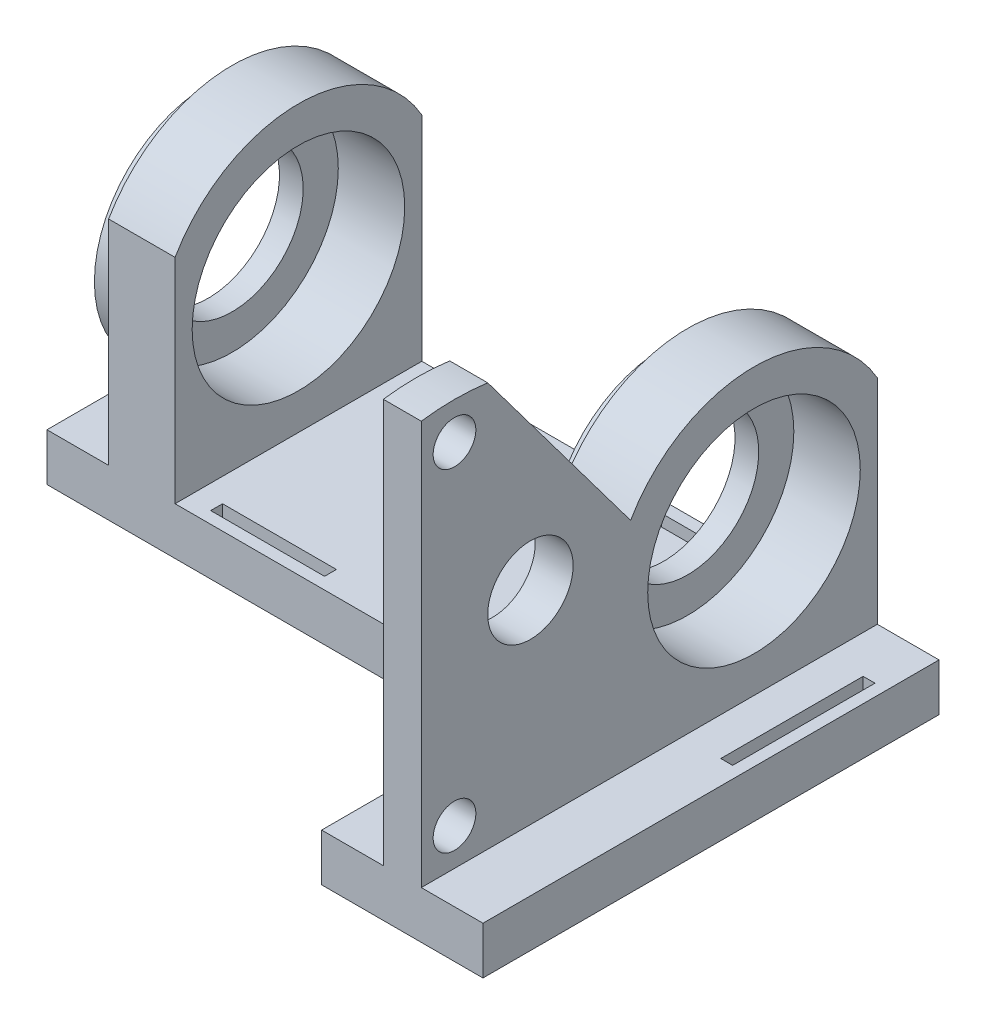
from build123d import *

# Parameters (mm, degrees)
SKETCH1_W                      = 20
SKETCH1_H                      = 26
SKETCH1_W_2                    = 1.25
SKETCH1_H_2                    = 15
BOSS_EXTRUDE5_DEPTH            = 5
SKETCH3_W                      = 7
SKETCH3_H                      = 26
BOSS_EXTRUDE6_DEPTH            = 40
CUT_EXTRUDE1_REACH             = 55.696
SKETCH5_R                      = 11.2
SKETCH6_W                      = 26
SKETCH6_H                      = 5
BOSS_EXTRUDE8_DEPTH            = 14
SKETCH8_R                      = 12
SKETCH8_R_2                    = 7.5
BOSS_EXTRUDE9_DEPTH            = 2.5
SKETCH9_R                      = 12
SKETCH9_R_2                    = 7.5
BOSS_EXTRUDE10_DEPTH           = 2.5
SKETCH7_W                      = 12
SKETCH7_H                      = 1.25
CUT_EXTRUDE2_DEPTH             = 10
BOSS_EXTRUDE11_DEPTH           = 37.12
SKETCH14_R                     = 2.25
SKETCH14_R_2                   = 4.5
CUT_EXTRUDE4_DEPTH             = 10
CUT_EXTRUDE5_REACH             = 85.48
CUT_EXTRUDE5_DIRECTION_2_REACH = 85.48


with BuildPart() as part:
    # Sketch1 → Boss-Extrude5 (new body)
    with BuildSketch(Plane(origin=(0, 0, 0), x_dir=(1, 0, 0), z_dir=(0, 1, 0))):
        with Locations((10, 13)):
            Rectangle(SKETCH1_W, SKETCH1_H)
        with Locations((1.875, 13)):
            Rectangle(SKETCH1_W_2, SKETCH1_H_2, mode=Mode.SUBTRACT)
    boss_extrude5 = extrude(amount=BOSS_EXTRUDE5_DEPTH)

    # Sketch3 → Boss-Extrude6 (add)
    with BuildSketch(Plane(origin=(0, 5, 0), x_dir=(1, 0, 0), z_dir=(0, 1, 0))):
        with Locations((10, 13)):
            Rectangle(SKETCH3_W, SKETCH3_H)
    boss_extrude6 = extrude(amount=BOSS_EXTRUDE6_DEPTH)

    # Sketch5 → Cut-Extrude1 (cut, up to next)
    with BuildSketch(Plane(origin=(13.5, 0, 0), x_dir=(0, 0, -1), z_dir=(1, 0, 0)), mode=Mode.PRIVATE) as cut_extrude1_sk1:
        with Locations((13, 20)):
            Circle(SKETCH5_R)
    cut_extrude1_tool1 = extrude(cut_extrude1_sk1.sketch, amount=-CUT_EXTRUDE1_REACH, mode=Mode.PRIVATE) & part.part
    # Sketch5 → Cut-Extrude1 (cut, up to next)
    with BuildSketch(Plane(origin=(13.5, 0, 0), x_dir=(0, 0, -1), z_dir=(1, 0, 0)), mode=Mode.PRIVATE) as cut_extrude1_sk2:
        with BuildLine():
            Line((0, 27.483314774), (0, 45))
            Line((0, 45), (26, 45))
            Line((26, 45), (26, 27.483314774))
            ThreePointArc((26, 27.483314774), (13, 35), (0, 27.483314774))
        make_face()
    cut_extrude1_tool2 = extrude(cut_extrude1_sk2.sketch, amount=-CUT_EXTRUDE1_REACH, mode=Mode.PRIVATE) & part.part
    cut_extrude1_1 = cut_extrude1_tool1.solids().sort_by_distance((13.5, 20, -13))[0]
    add(cut_extrude1_1, mode=Mode.SUBTRACT)
    cut_extrude1_2 = cut_extrude1_tool2.solids().sort_by_distance((13.5, 38.725293, -13))[0]
    add(cut_extrude1_2, mode=Mode.SUBTRACT)
    cut_extrude1 = cut_extrude1_1 + cut_extrude1_2  # Cut-Extrude1 as one shape, for the pattern or mirror that repeats it

    # Sketch6 → Boss-Extrude8 (add)
    with BuildSketch(Plane(origin=(20, 0, 0), x_dir=(0, 0, -1), z_dir=(1, 0, 0))):
        with Locations((13, 2.5)):
            Rectangle(SKETCH6_W, SKETCH6_H)
    boss_extrude8 = extrude(amount=BOSS_EXTRUDE8_DEPTH)

    # Mirror5: Boss-Extrude5, Boss-Extrude6, Cut-Extrude1, Boss-Extrude8 across plane
    add(boss_extrude5.mirror(Plane.ZY.offset(-34)))
    add(boss_extrude6.mirror(Plane.ZY.offset(-34)))
    add(cut_extrude1.mirror(Plane.ZY.offset(-34)), mode=Mode.SUBTRACT)
    add(boss_extrude8.mirror(Plane.ZY.offset(-34)))

    # Sketch8 → Boss-Extrude9 (add)
    with BuildSketch(Plane.ZY.offset(-6.5)):
        with Locations(Location((-13, 20, 0), (0, 0, 180))):
            Circle(SKETCH8_R)
        with Locations((-13, 20)):
            Circle(SKETCH8_R_2, mode=Mode.SUBTRACT)
    extrude(amount=BOSS_EXTRUDE9_DEPTH)

    # Sketch9 → Boss-Extrude10 (add)
    with BuildSketch(Plane.ZY.offset(-54.5)):
        with Locations(Location((-13, 20, 0), (0, 0, 180))):
            Circle(SKETCH9_R)
        with Locations((-13, 20)):
            Circle(SKETCH9_R_2, mode=Mode.SUBTRACT)
    extrude(amount=BOSS_EXTRUDE10_DEPTH)

    # Sketch7 → Cut-Extrude2 (cut)
    with BuildSketch(Plane(origin=(0, 5, 0), x_dir=(1, 0, 0), z_dir=(0, 1, 0))):
        with Locations((22, 1.875)):
            Rectangle(SKETCH7_W, SKETCH7_H)
        with Locations((46, 1.875)):
            Rectangle(SKETCH7_W, SKETCH7_H)
        with Locations((46, 24.125)):
            Rectangle(SKETCH7_W, SKETCH7_H)
        with Locations((22, 24.125)):
            Rectangle(SKETCH7_W, SKETCH7_H)
    extrude(amount=-CUT_EXTRUDE2_DEPTH, mode=Mode.SUBTRACT)

    # Sketch10 → Boss-Extrude11 (add)
    with BuildSketch(Plane.XY):
        Polygon((51, 0), (68, 0), (68, 5), (61.5, 5), (61.5, 47.8), (57.5, 47.8), (57.5, 5), (51, 5), align=None)
    extrude(amount=BOSS_EXTRUDE11_DEPTH)

    # Sketch14 → Cut-Extrude4 (cut)
    with BuildSketch(Plane(origin=(61.5, 0, 0), x_dir=(0, 0, -1), z_dir=(1, 0, 0))):
        Polygon((-37.12, 51.83243557), (-37.12, 47.8), (-18.56, 47.8), (0, 47.8), (0, 51.83243557), align=None)
        with BuildLine():
            Line((0, 47.8), (-18.56, 47.8))
            ThreePointArc((-18.56, 47.8), (-8.484558377, 45.75747818), (0, 39.952421039))
            Line((0, 39.952421039), (0, 47.8))
        make_face()
        with BuildLine():
            Line((-37.12, 47.8), (-37.12, 39.952421039))
            ThreePointArc((-37.12, 39.952421039), (-28.635441623, 45.75747818), (-18.56, 47.8))
            Line((-18.56, 47.8), (-37.12, 47.8))
        make_face()
        with Locations((-18.556883399, 43.896979327)):
            Circle(SKETCH14_R)
        with Locations((-10.556883399, 26.396979327)):
            Circle(SKETCH14_R_2)
        with Locations((-18.556883399, 8.896979327)):
            Circle(SKETCH14_R)
    extrude(amount=-CUT_EXTRUDE4_DEPTH, mode=Mode.SUBTRACT)

    # Cut-Extrude5: up to this face of the body (flat: up to its plane)
    cut_extrude5_end = Plane(part.part.faces().sort_by_distance((68, 2.5, 5.56))[0])
    # Sketch15 → Cut-Extrude5 (cut, up to the picked face)
    with BuildSketch(Plane.ZY.offset(-57.5), mode=Mode.PRIVATE) as cut_extrude5_sk1:
        with BuildLine():
            Line((37.12, 0), (37.12, 5))
            Line((37.12, 5), (37.12, 39.952421039))
            ThreePointArc((37.12, 39.952421039), (30.226412362, 45.020265293), (22.056883399, 47.562585579))
            Line((22.056883399, 47.562585579), (22.056883399, 0))
            Line((22.056883399, 0), (37.12, 0))
        make_face()
    cut_extrude5_tool1 = split(extrude(cut_extrude5_sk1.sketch, amount=-CUT_EXTRUDE5_REACH, mode=Mode.PRIVATE), bisect_by=cut_extrude5_end, keep=Keep.BOTH, mode=Mode.PRIVATE)
    # Sketch15 → Cut-Extrude5 (cut, up to the picked face)
    with BuildSketch(Plane.ZY.offset(-57.5), mode=Mode.PRIVATE) as cut_extrude5_sk2:
        with BuildLine():
            Line((0, 39.952421039), (0, 27.483314774))
            Line((0, 27.483314774), (15.056883399, 47.561734504))
            ThreePointArc((15.056883399, 47.561734504), (6.890780172, 45.018846696), (0, 39.952421039))
        make_face()
    cut_extrude5_tool2 = split(extrude(cut_extrude5_sk2.sketch, amount=-CUT_EXTRUDE5_REACH, mode=Mode.PRIVATE), bisect_by=cut_extrude5_end, keep=Keep.BOTH, mode=Mode.PRIVATE)
    add(cut_extrude5_tool1.solids().sort_by(Axis((57.5, 22.463316, 29.381371), (1, 0, 0)))[0], mode=Mode.SUBTRACT)
    add(cut_extrude5_tool2.solids().sort_by(Axis((57.5, 39.195611, 5.346979), (1, 0, 0)))[0], mode=Mode.SUBTRACT)

    # Cut-Extrude5 direction 2: up to this face of the body (flat: up to its plane)
    cut_extrude5_direction_2_end = Plane(part.part.faces().sort_by_distance((51, 2.5, 18.56))[0])
    # Sketch15 → Cut-Extrude5 direction 2 (cut, up to the picked face)
    with BuildSketch(Plane.ZY.offset(-57.5), mode=Mode.PRIVATE) as cut_extrude5_direction_2_sk1:
        with BuildLine():
            Line((37.12, 0), (37.12, 5))
            Line((37.12, 5), (37.12, 39.952421039))
            ThreePointArc((37.12, 39.952421039), (30.226412362, 45.020265293), (22.056883399, 47.562585579))
            Line((22.056883399, 47.562585579), (22.056883399, 0))
            Line((22.056883399, 0), (37.12, 0))
        make_face()
    cut_extrude5_direction_2_tool1 = split(extrude(cut_extrude5_direction_2_sk1.sketch, amount=CUT_EXTRUDE5_DIRECTION_2_REACH, mode=Mode.PRIVATE), bisect_by=cut_extrude5_direction_2_end, keep=Keep.BOTH, mode=Mode.PRIVATE)
    # Sketch15 → Cut-Extrude5 direction 2 (cut, up to the picked face)
    with BuildSketch(Plane.ZY.offset(-57.5), mode=Mode.PRIVATE) as cut_extrude5_direction_2_sk2:
        with BuildLine():
            Line((0, 39.952421039), (0, 27.483314774))
            Line((0, 27.483314774), (15.056883399, 47.561734504))
            ThreePointArc((15.056883399, 47.561734504), (6.890780172, 45.018846696), (0, 39.952421039))
        make_face()
    cut_extrude5_direction_2_tool2 = split(extrude(cut_extrude5_direction_2_sk2.sketch, amount=CUT_EXTRUDE5_DIRECTION_2_REACH, mode=Mode.PRIVATE), bisect_by=cut_extrude5_direction_2_end, keep=Keep.BOTH, mode=Mode.PRIVATE)
    add(cut_extrude5_direction_2_tool1.solids().sort_by(Axis((57.5, 22.463316, 29.381371), (-1, 0, 0)))[0], mode=Mode.SUBTRACT)
    add(cut_extrude5_direction_2_tool2.solids().sort_by(Axis((57.5, 39.195611, 5.346979), (-1, 0, 0)))[0], mode=Mode.SUBTRACT)


solid = part.part
